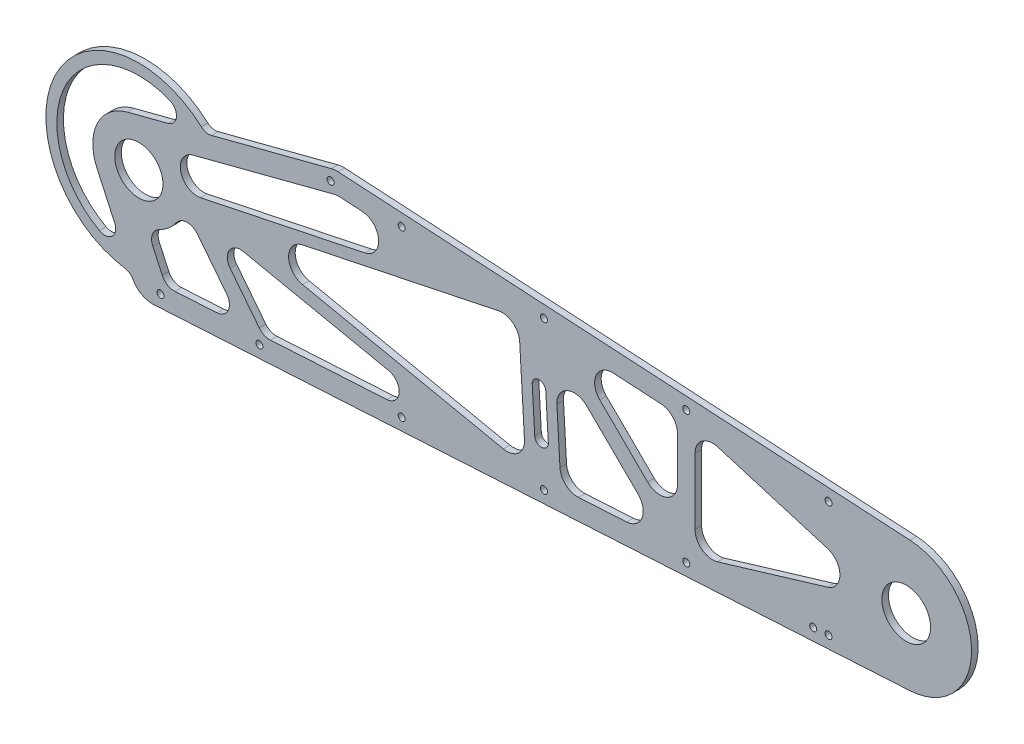
from build123d import *

# Parameters (mm, degrees)
SKETCH1_R               = 11.1125
SKETCH1_R_2             = 11
SKETCH1_R_3             = 1.6
BOSS_EXTRUDE1_DEPTH     = 3
M3_CLEARANCE_HOLE1_D    = 3.4
CUT_EXTRUDE1_DEPTH      = 10
BOSS_EXTRUDE4_START     = -3
SKETCH13_R              = 1.6
SKETCH13_R_2            = 1.7
BOSS_EXTRUDE4_DEPTH     = 3
CUT_EXTRUDE2_DEPTH      = 231.508134347
CUT_EXTRUDE2_DEPTH_BACK = 231.508134347
FILLET3_R               = 10
BOSS_EXTRUDE5_DEPTH     = 3
FILLET4_R               = 5


with BuildPart() as part:
    # Sketch1 → Boss-Extrude1 (new body)
    with BuildSketch(Plane.XY):
        with BuildLine():
            Line((-172.112162162, 49.916534261), (176.720292805, 29.735414369))
            ThreePointArc((176.720292805, 29.735414369), (204.785135135, 0), (176.720292805, -29.735414369))
            Line((176.720292805, -29.735414369), (-172.112162162, -49.916534261))
            ThreePointArc((-172.112162162, -49.916534261), (-225, 0), (-172.112162162, 49.916534261))
        make_face()
        with Locations((175, 0)):
            Circle(SKETCH1_R, mode=Mode.SUBTRACT)
        with Locations((-175, 0)):
            Circle(SKETCH1_R_2, mode=Mode.SUBTRACT)
        with Locations((-120, 41.392475449)):
            Circle(SKETCH1_R_3, mode=Mode.SUBTRACT)
        with Locations((-55.108505461, 37.63828626)):
            Circle(SKETCH1_R_3, mode=Mode.SUBTRACT)
        with Locations((9.782989078, 33.884097071)):
            Circle(SKETCH1_R_3, mode=Mode.SUBTRACT)
        with Locations((74.674483618, 30.129907882)):
            Circle(SKETCH1_R_3, mode=Mode.SUBTRACT)
        with Locations((139.565978157, 26.375718693)):
            Circle(SKETCH1_R_3, mode=Mode.SUBTRACT)
        with Locations(Location((139.565978157, -26.375718693, 0), (0, 0, 180))):
            Circle(SKETCH1_R_3, mode=Mode.SUBTRACT)
        with Locations(Location((74.674483618, -30.129907882, 0), (0, 0, 180))):
            Circle(SKETCH1_R_3, mode=Mode.SUBTRACT)
        with Locations(Location((9.782989078, -33.884097071, 0), (0, 0, 180))):
            Circle(SKETCH1_R_3, mode=Mode.SUBTRACT)
        with Locations(Location((-55.108505461, -37.63828626, 0), (0, 0, 180))):
            Circle(SKETCH1_R_3, mode=Mode.SUBTRACT)
        with Locations(Location((-120, -41.392475449, 0), (0, 0, 180))):
            Circle(SKETCH1_R_3, mode=Mode.SUBTRACT)
        with Locations((-87.55425273, 39.515380855)):
            Circle(SKETCH1_R_3, mode=Mode.SUBTRACT)
        with Locations((-165.112162162, -44.002364352)):
            Circle(SKETCH1_R_3, mode=Mode.SUBTRACT)
        with Locations(Location((-165.112162162, 44.002364352, 0), (0, 0, 180))):
            Circle(SKETCH1_R_3, mode=Mode.SUBTRACT)
        with Locations((132.57766336, -26.78001599)):
            Circle(SKETCH1_R_3, mode=Mode.SUBTRACT)
    extrude(amount=BOSS_EXTRUDE1_DEPTH)

    # M3 Clearance Hole1 (through all)
    with Locations(Plane.XY.offset(3)):
        with Locations((-197.5, 0), (-175, 22.5), (-152.5, 0), (-175, -22.5)):
            Hole(M3_CLEARANCE_HOLE1_D / 2)

    # Sketch7 → Cut-Extrude1 (cut)
    with BuildSketch(Plane.XY.offset(3)):
        with BuildLine():
            Line((88.975526403, 22.70262828), (139.057512253, 7.661932008))
            ThreePointArc((139.057512253, 7.661932008), (144.756469468, 0), (139.057512253, -7.661932008))
            Line((139.057512253, -7.661932008), (88.975526403, -22.70262828))
            ThreePointArc((88.975526403, -22.70262828), (81.899985858, -21.459743798), (78.674483618, -15.040696272))
            Line((78.674483618, -15.040696272), (78.674483618, 15.040696272))
            ThreePointArc((78.674483618, 15.040696272), (81.899985858, 21.459743798), (88.975526403, 22.70262828))
        make_face()
        with BuildLine():
            Line((70.674483618, -1.435965036), (70.674483618, 18.804082595))
            ThreePointArc((70.674483618, 18.804082595), (68.492405602, 24.295146589), (63.136537672, 26.790728077))
            Line((63.136537672, 26.790728077), (41.340803255, 28.05168394))
            ThreePointArc((41.340803255, 28.05168394), (33.5681452, 23.313895048), (35.260532637, 14.369808645))
            Line((35.260532637, 14.369808645), (57.056267053, -7.13119485))
            ThreePointArc((57.056267053, -7.13119485), (65.761089155, -8.816538609), (70.674483618, -1.435965036))
        make_face()
        with BuildLine():
            Line((29.274282074, 9.037636121), (52.642195402, -14.014286633))
            ThreePointArc((52.642195402, -14.014286633), (54.510022559, -22.530712895), (47.486032892, -27.696161929))
            Line((47.486032892, -27.696161929), (25.525253015, -28.966666222))
            ThreePointArc((25.525253015, -28.966666222), (19.742509337, -26.954153474), (17.076553479, -21.442074794))
            Line((17.076553479, -21.442074794), (15.669420028, 2.880352253))
            ThreePointArc((15.669420028, 2.880352253), (20.357520369, 10.630725727), (29.274282074, 9.037636121))
        make_face()
        with BuildLine():
            Line((0.888857819, -18.660178632), (-1.297304055, 19.127824103))
            ThreePointArc((-1.297304055, 19.127824103), (-4.419663172, 25.017046941), (-10.919058578, 26.496888642))
            Line((-10.919058578, 26.496888642), (-100.316068348, 7.831118593))
            ThreePointArc((-100.316068348, 7.831118593), (-106.680959307, 0), (-100.316068348, -7.831118593))
            Line((-100.316068348, -7.831118593), (-8.732896703, -26.953351279))
            ThreePointArc((-8.732896703, -26.953351279), (-1.874792168, -25.181961893), (0.888857819, -18.660178632))
        make_face()
        with BuildLine():
            Line((5.567875781, -14.698862148), (4.412740646, 5.267751556))
            ThreePointArc((4.412740646, 5.267751556), (7.328519824, 8.541622626), (10.602390894, 5.625843448))
            Line((10.602390894, 5.625843448), (11.757526029, -14.340770256))
            ThreePointArc((11.757526029, -14.340770256), (8.841746851, -17.614641327), (5.567875781, -14.698862148))
        make_face()
        with BuildLine():
            Line((-168.628817462, -26.780813035), (-164.328820539, -36.131704715))
            ThreePointArc((-164.328820539, -36.131704715), (-161.9675088, -38.768125945), (-158.531024529, -39.614935187))
            Line((-158.531024529, -39.614935187), (-139.338201161, -38.504566401))
            ThreePointArc((-139.338201161, -38.504566401), (-134.215269125, -34.981335164), (-134.965576917, -28.809250491))
            Line((-134.965576917, -28.809250491), (-148.244899035, -11.896511575))
            ThreePointArc((-148.244899035, -11.896511575), (-153.112679512, -9.603684208), (-157.860938526, -12.134767068))
            ThreePointArc((-157.860938526, -12.134767068), (-161.407808519, -16.007883394), (-165.804770439, -18.879823975))
            ThreePointArc((-165.804770439, -18.879823975), (-168.827500209, -22.25460448), (-168.628817462, -26.780813035))
        make_face()
        with BuildLine():
            Line((-115.014849323, -37.097379447), (-61.915594024, -34.025410592))
            ThreePointArc((-61.915594024, -34.025410592), (-56.278566205, -28.479171543), (-61.035802784, -22.162087536))
            Line((-61.035802784, -22.162087536), (-127.432068804, -8.298789011))
            ThreePointArc((-127.432068804, -8.298789011), (-133.756214224, -11.00790671), (-133.377565369, -17.877459755))
            Line((-133.377565369, -17.877459755), (-120.080554648, -34.812727134))
            ThreePointArc((-120.080554648, -34.812727134), (-117.828142738, -36.576867912), (-115.014849323, -37.097379447))
        make_face()
    extrude(amount=-CUT_EXTRUDE1_DEPTH, mode=Mode.SUBTRACT)

    # Sketch13 → Boss-Extrude4 (add)
    with BuildSketch(Plane.XY.offset(3).offset(BOSS_EXTRUDE4_START)):
        with Locations((-120, 41.392475449)):
            Circle(SKETCH13_R)
        with Locations((-165.112162162, 44.002364352)):
            Circle(SKETCH13_R)
        with Locations((-152.5, 0)):
            Circle(SKETCH13_R_2)
        with Locations((-175, 22.5)):
            Circle(SKETCH13_R_2)
        with Locations((-197.5, 0)):
            Circle(SKETCH13_R_2)
        with Locations((-175, -22.5)):
            Circle(SKETCH13_R_2)
    extrude(amount=BOSS_EXTRUDE4_DEPTH)

    # Sketch12 → Cut-Extrude2 (cut, two sides: drawn at the far end of the back side and taken through both)
    with BuildSketch(Plane.XY.offset(-CUT_EXTRUDE2_DEPTH_BACK)):
        with BuildLine():
            Line((-180.282068296, 20.324855584), (-85.661443891, 44.91507214))
            Line((-85.661443891, 44.91507214), (-172.112162162, 49.916534261))
            ThreePointArc((-172.112162162, 49.916534261), (-224.977336227, 1.505278598), (-175.121566215, -49.999852216))
            Line((-175.121566215, -49.999852216), (-194.079394143, -8.773637737))
            ThreePointArc((-194.079394143, -8.773637737), (-193.975004386, 8.997177811), (-180.282068296, 20.324855584))
        make_face()
        with BuildLine():
            Line((-150.319376569, 18.296058095), (-85.936217247, 35.028095536))
            ThreePointArc((-85.936217247, 35.028095536), (-84.708612627, 35.246724449), (-83.461946699, 35.27193889))
            Line((-83.461946699, 35.27193889), (-73.144213844, 34.675023664))
            ThreePointArc((-73.144213844, 34.675023664), (-65.628176752, 27.280038265), (-71.971158858, 18.857259589))
            Line((-71.971158858, 18.857259589), (-146.792139826, 3.234911267))
            ThreePointArc((-146.792139826, 3.234911267), (-155.906193385, 9.044053679), (-150.319376569, 18.296058095))
        make_face()
    extrude(amount=CUT_EXTRUDE2_DEPTH + CUT_EXTRUDE2_DEPTH_BACK, mode=Mode.SUBTRACT)

    # Fillet3
    fillet3_edges = [part.edges().sort_by_distance(p)[0] for p in [
        (-85.661443891, 44.91507214, 1.5),
        (-175.121566215, -49.999852216, 1.5),
    ]]
    fillet(fillet3_edges, radius=FILLET3_R)

    # Sketch14 → Boss-Extrude5 (add)
    with BuildSketch(Plane(origin=(0, 0, 0), x_dir=(-1, 0, 0), z_dir=(0, 0, -1))):
        with BuildLine():
            Line((181.149685122, -36.8909389), (178.690340293, -42.239097866))
            ThreePointArc((178.690340293, -42.239097866), (213.311437426, 18.165730438), (144.63205556, 29.58965952))
            Line((144.63205556, 29.58965952), (150.329330737, 28.109039082))
            ThreePointArc((150.329330737, 28.109039082), (208.793579239, 16.023545245), (181.149685122, -36.8909389))
        make_face()
    extrude(amount=-BOSS_EXTRUDE5_DEPTH)

    # Fillet4
    fillet4_edges = [part.edges().sort_by_distance(p)[0] for p in [
        (-178.690340293, -42.239097866, 1.5),
        (-181.149685122, -36.8909389, 1.5),
        (-144.63205556, 29.58965952, 1.5),
        (-150.329330737, 28.109039082, 1.5),
    ]]
    fillet(fillet4_edges, radius=FILLET4_R)


solid = part.part
